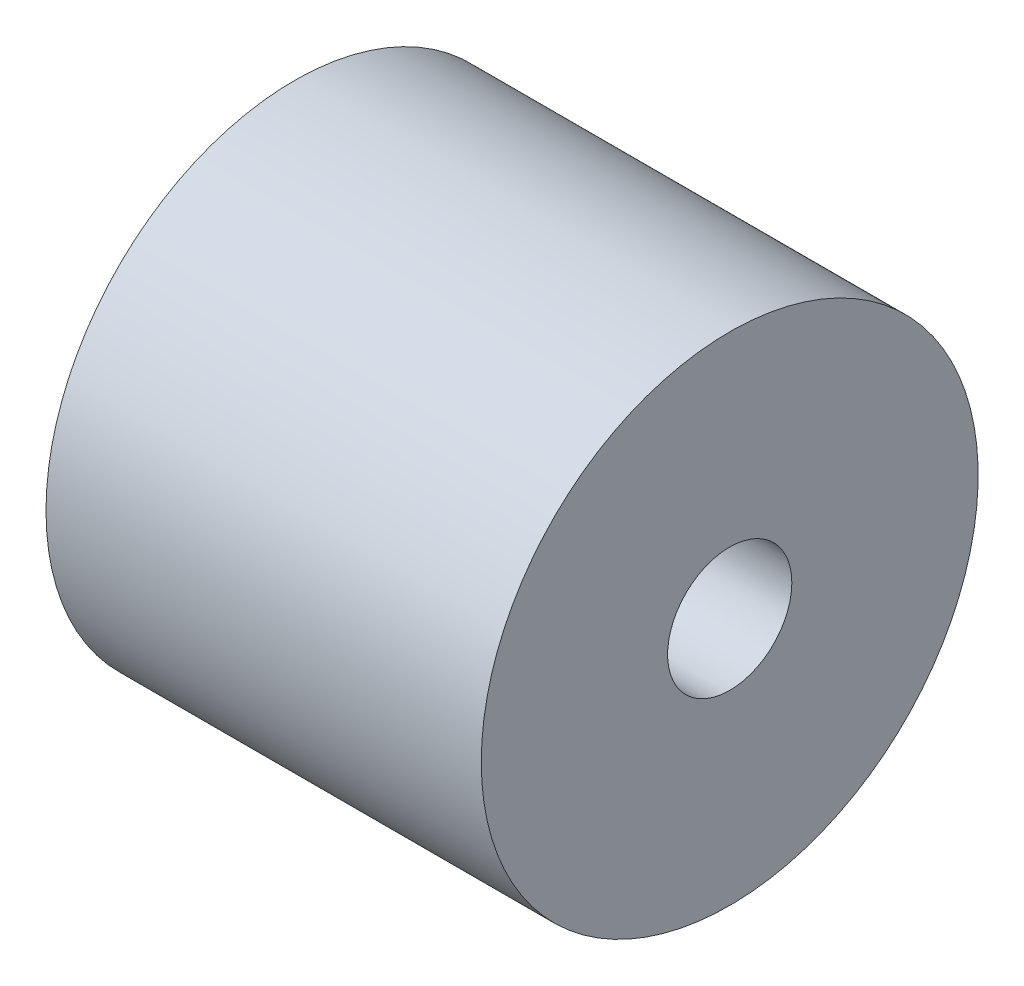
from build123d import *

# Parameters (mm, degrees)
SKETCH1_R           = 6.35
SKETCH1_R_2         = 3.175
BOSS_EXTRUDE1_DEPTH = 11.1252
BOSS_EXTRUDE2_START = -5.5626
SKETCH2_R           = 3.175
SKETCH2_R_2         = 1.5875
BOSS_EXTRUDE2_DEPTH = 5.5626


with BuildPart() as part:
    # Sketch1 → Boss-Extrude1 (new body)
    with BuildSketch(Plane(origin=(0, 0, 0), x_dir=(0, 0, -1), z_dir=(1, 0, 0))):
        with Locations(Location((0, 0, 0), (0, 0, 180))):
            Circle(SKETCH1_R)
        with Locations(Location((0, 0, 0), (0, 0, 180))):
            Circle(SKETCH1_R_2, mode=Mode.SUBTRACT)
    extrude(amount=BOSS_EXTRUDE1_DEPTH)

    # Sketch2 → Boss-Extrude2 (add)
    with BuildSketch(Plane(origin=(11.1252, 0, 0), x_dir=(0, 0, -1), z_dir=(1, 0, 0)).offset(BOSS_EXTRUDE2_START)):
        with Locations(Location((0, 0, 0), (0, 0, 180))):
            Circle(SKETCH2_R)
        Circle(SKETCH2_R_2, mode=Mode.SUBTRACT)
    extrude(amount=BOSS_EXTRUDE2_DEPTH)


solid = part.part
